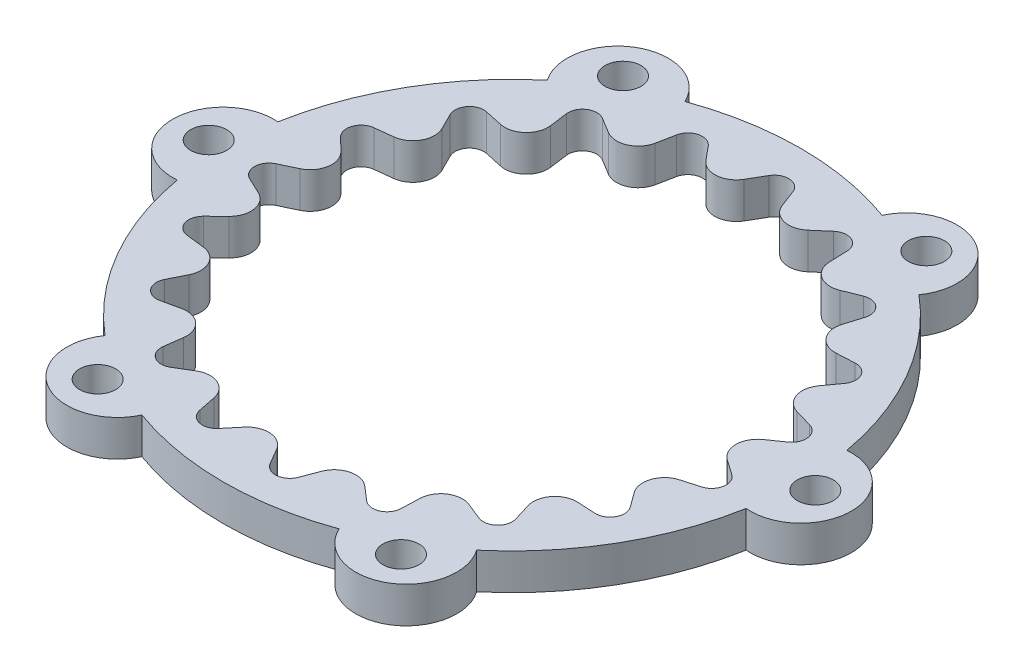
from build123d import *

# Parameters (mm, degrees)
BOSS_EXTRUDE1_DEPTH = 3.175
CIRPATTERN4_COUNT   = 19
FILLET1_R           = 2.54
BOSS_EXTRUDE2_DEPTH = 6.35
SKETCH7_R           = 3.175
CUT_EXTRUDE3_DEPTH  = 6.35
CIRPATTERN5_COUNT   = 6


with BuildPart() as part:
    # Sketch1 → Boss-Extrude1 (new, symmetric)
    with BuildSketch(Plane(origin=(0, 0, 0), x_dir=(1, 0, 0), z_dir=(0, 1, 0))):
        with BuildLine():
            Line((40.994673778, 3.120969289), (49.927314923, 9.375671955))
            ThreePointArc((49.927314923, 9.375671955), (50.8, 0), (49.927314923, -9.375671955))
            Line((49.927314923, -9.375671955), (40.994673778, -3.120969289))
            ThreePointArc((40.994673778, -3.120969289), (39.37, 0), (40.994673778, 3.120969289))
        make_face()
    boss_extrude1 = extrude(amount=BOSS_EXTRUDE1_DEPTH, both=True)

    # CirPattern4: Boss-Extrude1 ×19 about axis
    cirpattern4_axis = Axis((0, 0, 0), (0, 1, 0))
    for i in range(1, CIRPATTERN4_COUNT):
        add(boss_extrude1.rotate(cirpattern4_axis, i * 360 / CIRPATTERN4_COUNT))

    # Fillet1
    fillet1_edges = [part.edges().sort_by_distance(p)[0] for p in [
        (47.969309878, 0, 8.004662063),
        (47.969309878, 0, -8.004662063),
        (42.771090832, 0, 23.146556848),
        (32.937960433, 0, 35.780163044),
        (19.535490936, 0, 44.536433387),
        (4.016047871, 0, 48.466490119),
        (-11.938596296, 0, 47.144450611),
        (-26.599508308, 0, 40.713578358),
        (-38.37795086, 0, 29.870758154),
        (-45.997546942, 0, 15.790977811),
        (-48.632595087, 0, 0),
        (-45.997546942, 0, -15.790977811),
        (-38.37795086, 0, -29.870758154),
        (-26.599508308, 0, -40.713578358),
        (-11.938596296, 0, -47.144450611),
        (4.016047871, 0, -48.466490119),
        (19.535490936, 0, -44.536433387),
        (32.937960433, 0, -35.780163044),
        (42.771090832, 0, -23.146556848),
    ]]
    fillet(fillet1_edges, radius=FILLET1_R)

    # Sketch5 → Boss-Extrude2 (add)
    with BuildSketch(Plane(origin=(0, 3.175, 0), x_dir=(1, 0, 0), z_dir=(0, 1, 0))):
        with BuildLine():
            Line((50.022125, -8.855902579), (45.72, 0))
            Line((45.72, 0), (50.022125, 8.855902579))
            ThreePointArc((50.022125, 8.855902579), (59.69, 0), (50.022125, -8.855902579))
        make_face()
    boss_extrude2 = extrude(amount=-BOSS_EXTRUDE2_DEPTH)

    # Sketch7 → Cut-Extrude3 (cut)
    with BuildSketch(Plane(origin=(0, 3.175, 0), x_dir=(1, 0, 0), z_dir=(0, 1, 0))):
        with Locations(Location((53.34, 0, 0), (0, 0, 270))):
            Circle(SKETCH7_R)
    cut_extrude3 = extrude(amount=-CUT_EXTRUDE3_DEPTH, mode=Mode.SUBTRACT)

    # CirPattern5: Boss-Extrude2, Cut-Extrude3 ×6 about axis
    cirpattern5_axis = Axis((0, 0, 0), (0, 1, 0))
    add([boss_extrude2.rotate(cirpattern5_axis, i * 360 / CIRPATTERN5_COUNT) for i in range(1, CIRPATTERN5_COUNT)])
    add([cut_extrude3.rotate(cirpattern5_axis, i * 360 / CIRPATTERN5_COUNT) for i in range(1, CIRPATTERN5_COUNT)], mode=Mode.SUBTRACT)


solid = part.part
